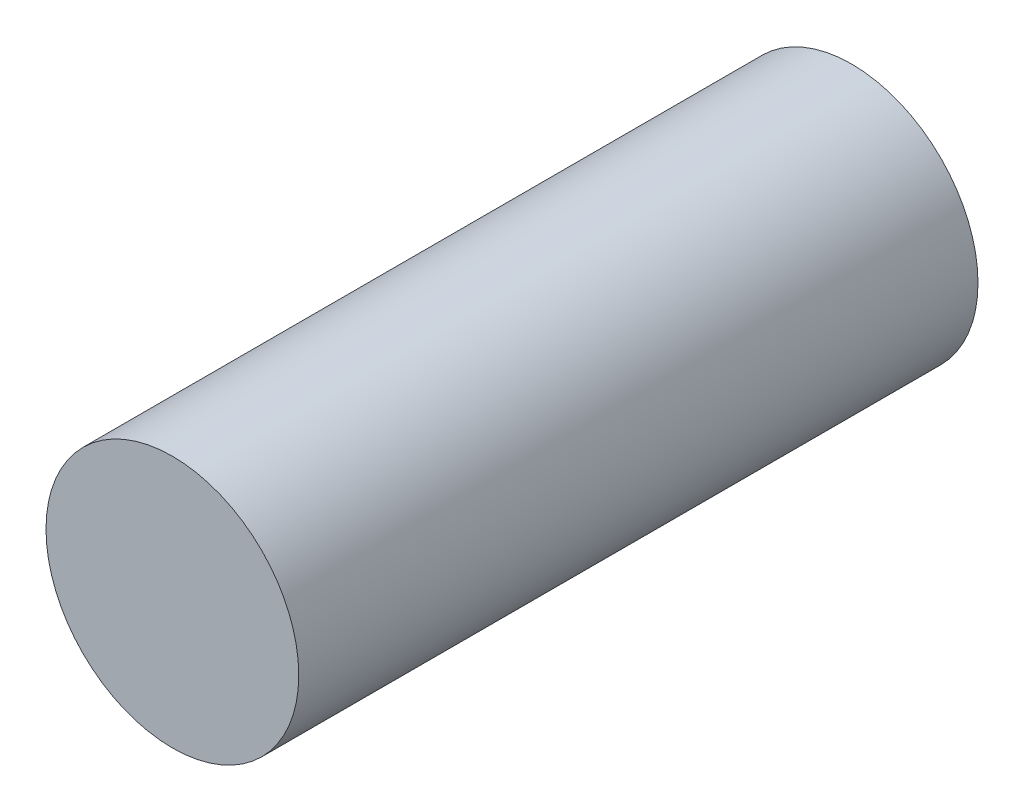
from build123d import *

# Parameters (mm, degrees)
SKETCH1_R           = 4
BOSS_EXTRUDE1_DEPTH = 21.5
CUT_EXTRUDE1_START  = -3
SKETCH2_W           = 2.50000008
SKETCH2_H           = 3.251715676
CUT_EXTRUDE1_DEPTH  = 15
FILLET2_R           = 1.5
FILLET3_R           = 1.5


with BuildPart() as part:
    # Sketch1 → Boss-Extrude1 (new body)
    with BuildSketch(Plane.XY):
        Circle(SKETCH1_R)
    extrude(amount=BOSS_EXTRUDE1_DEPTH)

    # Sketch2 → Cut-Extrude1 (cut)
    with BuildSketch(Plane.XY.offset(21.5).offset(CUT_EXTRUDE1_START)):
        with Locations((-4, 0)):
            Rectangle(SKETCH2_W, SKETCH2_H)
    extrude(amount=-CUT_EXTRUDE1_DEPTH, mode=Mode.SUBTRACT)

    # Fillet2
    fillet2_edges = [part.edges().sort_by_distance(p)[0] for p in [
        (-3.202333166, -1.625857838, 3.5),
        (-3.202333166, 1.625857838, 3.5),
    ]]
    fillet(fillet2_edges, radius=FILLET2_R)

    # Fillet3
    fillet3_edges = [part.edges().sort_by_distance(p)[0] for p in [
        (-3.202333166, 1.625857838, 18.5),
        (-3.202333166, -1.625857838, 18.5),
    ]]
    fillet(fillet3_edges, radius=FILLET3_R)


solid = part.part
